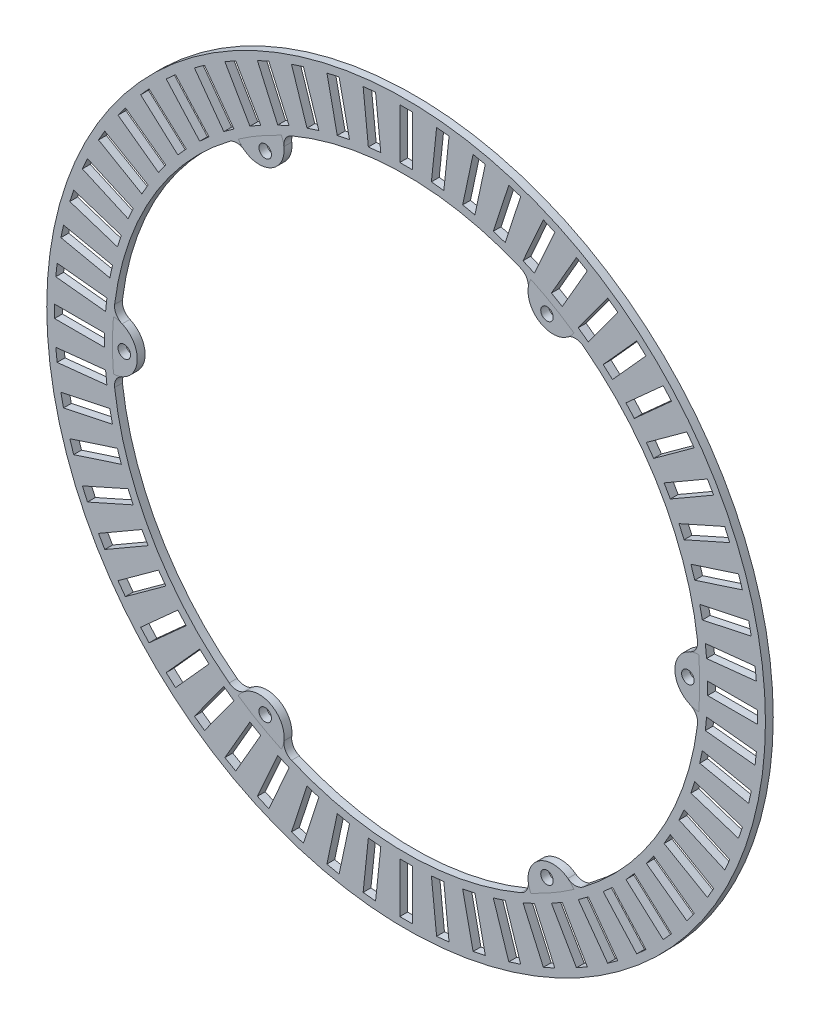
from build123d import *

# Parameters (mm, degrees)
SKETCH1_R                 = 72.9615
SKETCH1_R_2               = 59.6265
BOSS_EXTRUDE1_DEPTH       = 1.5875
SKETCH4_W                 = 2.54
SKETCH4_H                 = 10.16
CUT_EXTRUDE3_DEPTH        = 5.08
CIRPATTERN2_COUNT         = 60
BOSS_EXTRUDE2_START       = -1.5875
BOSS_EXTRUDE2_DEPTH       = 1.587512
FILLET1_R                 = 2.54
SKETCH9_R                 = 1.27
CUT_EXTRUDE6_DEPTH        = 104.19535449
CIRPATTERN12_COUNT        = 6
FILLET1_OF_CIRPATTERN12_R = 2.54


with BuildPart() as part:
    # Sketch1 → Boss-Extrude1 (new body)
    with BuildSketch(Plane.XY):
        Circle(SKETCH1_R)
        Circle(SKETCH1_R_2, mode=Mode.SUBTRACT)
    extrude(amount=BOSS_EXTRUDE1_DEPTH)

    # Sketch4 → Cut-Extrude3 (cut)
    with BuildSketch(Plane.XY.offset(1.5875)):
        with Locations((0, 66.294)):
            Rectangle(SKETCH4_W, SKETCH4_H)
    cut_extrude3 = extrude(amount=-CUT_EXTRUDE3_DEPTH, mode=Mode.SUBTRACT)

    # CirPattern2: Cut-Extrude3 ×60 about axis
    cirpattern2_axis = Axis((0, 0, 0), (0, 0, 1))
    for i in range(1, CIRPATTERN2_COUNT):
        add(cut_extrude3.rotate(cirpattern2_axis, i * 360 / CIRPATTERN2_COUNT), mode=Mode.SUBTRACT)

    # Sketch8 → Boss-Extrude2 (add)
    with BuildSketch(Plane.XY.offset(1.5875).offset(BOSS_EXTRUDE2_START)):
        with BuildLine():
            ThreePointArc((59.41258037, 5.046265558), (54.575702272, 0), (59.41258037, -5.046265558))
            ThreePointArc((59.41258037, -5.046265558), (59.6265, 0), (59.41258037, 5.046265558))
        make_face()
    boss_extrude2 = extrude(amount=BOSS_EXTRUDE2_DEPTH)

    # Fillet1
    fillet1_edges = [part.edges().sort_by_distance(p)[0] for p in [
        (59.41258037, 5.046265558, 0.79375),
        (59.41258037, -5.046265558, 0.79375),
    ]]
    fillet(fillet1_edges, radius=FILLET1_R)

    # Sketch9 → Cut-Extrude6 (cut, symmetric)
    with BuildSketch(Plane.XY.offset(1.587512)):
        with Locations((57.213507434, 0)):
            Circle(SKETCH9_R)
    cut_extrude6 = extrude(amount=CUT_EXTRUDE6_DEPTH, both=True, mode=Mode.SUBTRACT)

    # CirPattern12: Boss-Extrude2, Cut-Extrude6 ×6 about axis
    cirpattern12_axis = Axis((0, 0, 0), (0, 0, 1))
    add([boss_extrude2.rotate(cirpattern12_axis, i * 360 / CIRPATTERN12_COUNT) for i in range(1, CIRPATTERN12_COUNT)])
    add([cut_extrude6.rotate(cirpattern12_axis, i * 360 / CIRPATTERN12_COUNT) for i in range(1, CIRPATTERN12_COUNT)], mode=Mode.SUBTRACT)

    # Fillet1 of CirPattern12
    fillet1_of_cirpattern12_edges = [part.edges().sort_by_distance(p)[0] for p in [
        (25.336096017, 53.975936683, 0.79375),
        (34.076484352, 48.929671125, 0.79375),
        (-34.076484352, 48.929671125, 0.79375),
        (-25.336096017, 53.975936683, 0.79375),
        (-59.41258037, -5.046265558, 0.79375),
        (-59.41258037, 5.046265558, 0.79375),
        (-25.336096017, -53.975936683, 0.79375),
        (-34.076484352, -48.929671125, 0.79375),
        (34.076484352, -48.929671125, 0.79375),
        (25.336096017, -53.975936683, 0.79375),
    ]]
    fillet(fillet1_of_cirpattern12_edges, radius=FILLET1_OF_CIRPATTERN12_R)


solid = part.part
